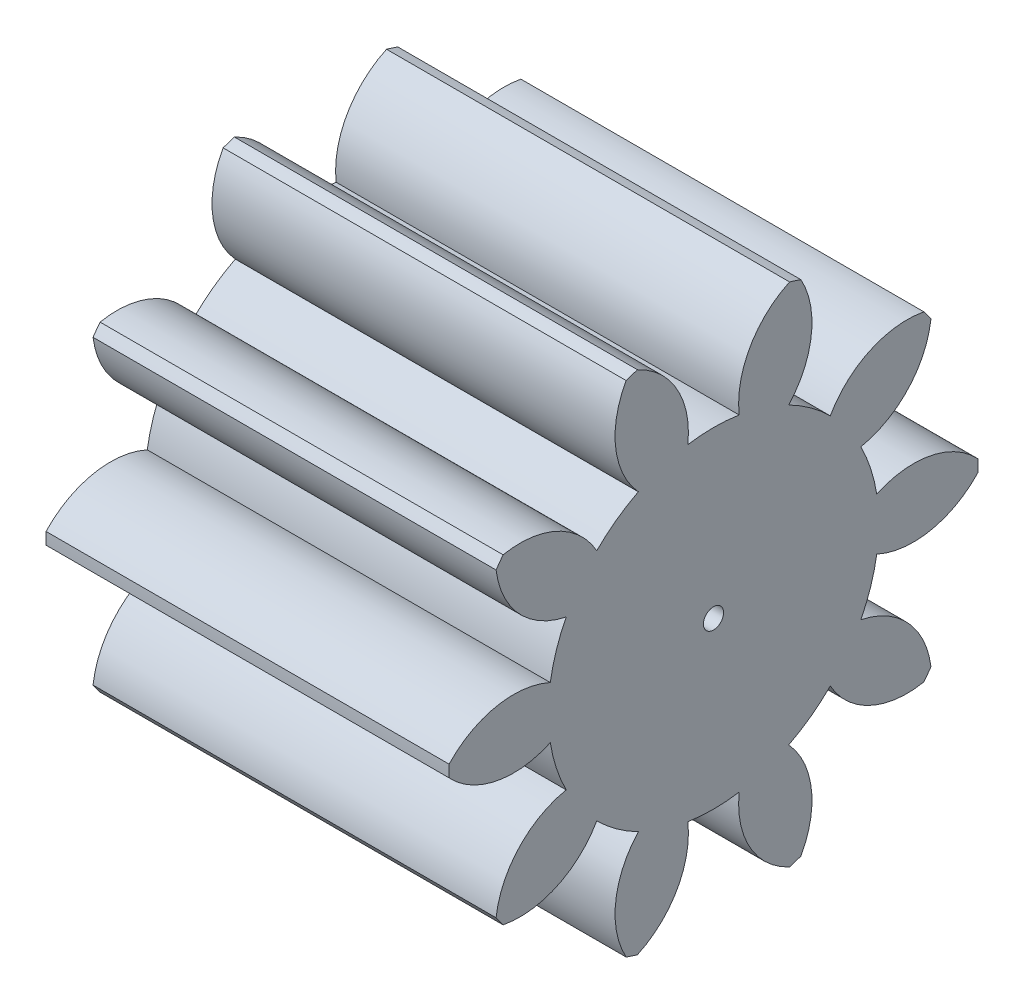
from build123d import *

# Parameters (mm, degrees)
BASPROSKE_W     = 16
BASPROSKE_H     = 10.5
TOOTHCUT_DEPTH  = 22.828879953
TEETHCUTS_COUNT = 10
TEETHCUTS_ANGLE = 324
BORSKE_R        = 0.4
BORE_DEPTH      = 50.0000508


with BuildPart() as part:
    # BasProSke → Base-Revolve (revolve)
    with BuildSketch(Plane(origin=(0, 0, 0), x_dir=(1, 0, 0), z_dir=(0, 1, 0)), mode=Mode.PRIVATE) as base_revolve_sk:
        with Locations((8, 5.25)):
            Rectangle(BASPROSKE_W, BASPROSKE_H)
    revolve(base_revolve_sk.sketch.rotate(Axis((-10, 0, 0), (1, 0, 0)), 180), axis=Axis((-10, 0, 0), (1, 0, 0)))

    # TooCutSke → ToothCut (cut, through all)
    with BuildSketch(Plane(origin=(0, 0, 0), x_dir=(0, 0, -1), z_dir=(1, 0, 0))):
        with BuildLine():
            ThreePointArc((1.019600066, 6.481797432), (0, 6.5615), (-1.019600066, 6.481797432))
            ThreePointArc((-1.019600066, 6.481797432), (-1.451036104, 8.608938557), (-3.053606956, 10.072712133))
            ThreePointArc((-3.053606956, 10.072712133), (0, 10.5254), (3.053606956, 10.072712133))
            ThreePointArc((3.053606956, 10.072712133), (1.451036104, 8.608938557), (1.019600066, 6.481797432))
        make_face()
    toothcut = extrude(amount=TOOTHCUT_DEPTH, mode=Mode.SUBTRACT)

    # TeethCuts: ToothCut ×10 about axis
    teethcuts_axis = Axis((-10, 0, 0), (1, 0, 0))
    for i in range(1, TEETHCUTS_COUNT):
        add(toothcut.rotate(teethcuts_axis, i * TEETHCUTS_ANGLE / (TEETHCUTS_COUNT - 1)), mode=Mode.SUBTRACT)

    # BorSke → Bore (cut, symmetric)
    with BuildSketch(Plane(origin=(0, 0, 0), x_dir=(0, 0, -1), z_dir=(1, 0, 0))):
        with Locations(Location((0, 0, 0), (0, 0, 180))):
            Circle(BORSKE_R)
    extrude(amount=BORE_DEPTH, both=True, mode=Mode.SUBTRACT)


solid = part.part
